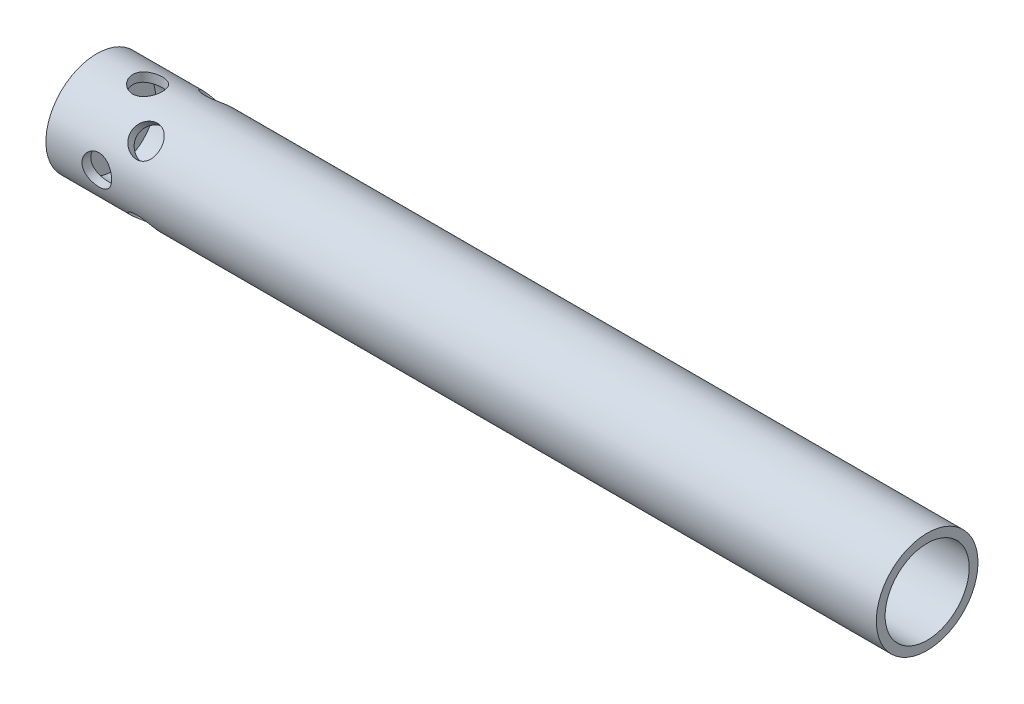
from build123d import *

# Parameters (mm, degrees)
SKETCH1_R           = 9.525
SKETCH1_R_2         = 7.874
BOSS_EXTRUDE1_DEPTH = 152.4
BOSS_EXTRUDE2_START = -3.175
SKETCH2_R           = 9.525
BOSS_EXTRUDE2_DEPTH = 3.175
SKETCH3_R           = 2.778125
CUT_EXTRUDE1_DEPTH  = 12.7
CIRPATTERN1_COUNT   = 2
CIRPATTERN1_ANGLE   = 90
SKETCH4_R           = 2.778125
CUT_EXTRUDE2_DEPTH  = 12.7
CIRPATTERN2_COUNT   = 2
CIRPATTERN2_ANGLE   = 90


with BuildPart() as part:
    # Sketch1 → Boss-Extrude1 (new body)
    with BuildSketch(Plane(origin=(0, 0, 0), x_dir=(0, 0, -1), z_dir=(1, 0, 0))):
        with Locations(Location((0, 0, 0), (0, 0, 180))):
            Circle(SKETCH1_R)
        with Locations(Location((0, 0, 0), (0, 0, 180))):
            Circle(SKETCH1_R_2, mode=Mode.SUBTRACT)
    extrude(amount=BOSS_EXTRUDE1_DEPTH)

    # Sketch2 → Boss-Extrude2 (add)
    with BuildSketch(Plane(origin=(0, 0, 0), x_dir=(0, 0, -1), z_dir=(1, 0, 0)).offset(BOSS_EXTRUDE2_START)):
        with Locations(Location((0, 0, 0), (0, 0, 180))):
            Circle(SKETCH2_R)
    extrude(amount=BOSS_EXTRUDE2_DEPTH)

    # Sketch3 → Cut-Extrude1 (cut, symmetric)
    with BuildSketch(Plane.XY):
        with Locations((6.35, 0)):
            Circle(SKETCH3_R)
    cut_extrude1 = extrude(amount=CUT_EXTRUDE1_DEPTH, both=True, mode=Mode.SUBTRACT)

    # CirPattern1: Cut-Extrude1 ×2 about axis
    cirpattern1_axis = Axis((152.4, 0, 0), (-1, 0, 0))
    for i in range(1, CIRPATTERN1_COUNT):
        add(cut_extrude1.rotate(cirpattern1_axis, i * CIRPATTERN1_ANGLE / (CIRPATTERN1_COUNT - 1)), mode=Mode.SUBTRACT)

    # Sketch4 → Cut-Extrude2 (cut, symmetric)
    with BuildSketch(Plane(origin=(0, 0, 0), x_dir=(1, 0, 0), z_dir=(0, -0.7071067811865488, 0.7071067811865464))):
        with Locations(Location((12.7, 0, 0), (0, 0, 270))):
            Circle(SKETCH4_R)
    cut_extrude2 = extrude(amount=CUT_EXTRUDE2_DEPTH, both=True, mode=Mode.SUBTRACT)

    # CirPattern2: Cut-Extrude2 ×2 about axis
    cirpattern2_axis = Axis((152.4, 0, 0), (-1, 0, 0))
    for i in range(1, CIRPATTERN2_COUNT):
        add(cut_extrude2.rotate(cirpattern2_axis, i * CIRPATTERN2_ANGLE / (CIRPATTERN2_COUNT - 1)), mode=Mode.SUBTRACT)


solid = part.part
